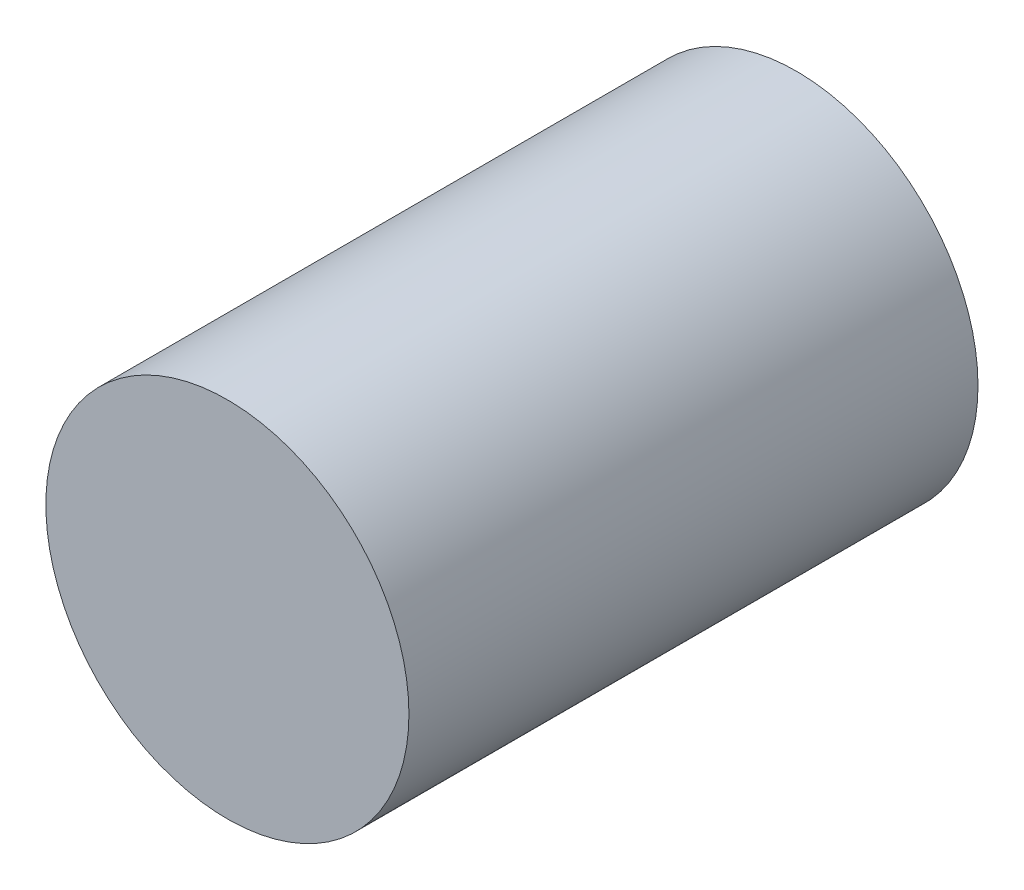
from build123d import *

# Parameters (mm, degrees)
SKETCH5_R           = 95.709377651
BOSS_EXTRUDE2_DEPTH = 300.0001


with BuildPart() as part:
    # Sketch5 → Boss-Extrude2 (new body)
    with BuildSketch(Plane.XY):
        Circle(SKETCH5_R)
    extrude(amount=-BOSS_EXTRUDE2_DEPTH)


with BuildPart() as part_1:
    # Body-Move/Copy2: moved
    add(part.part.moved(Location((0, 0, 100))))


solid = part_1.part
